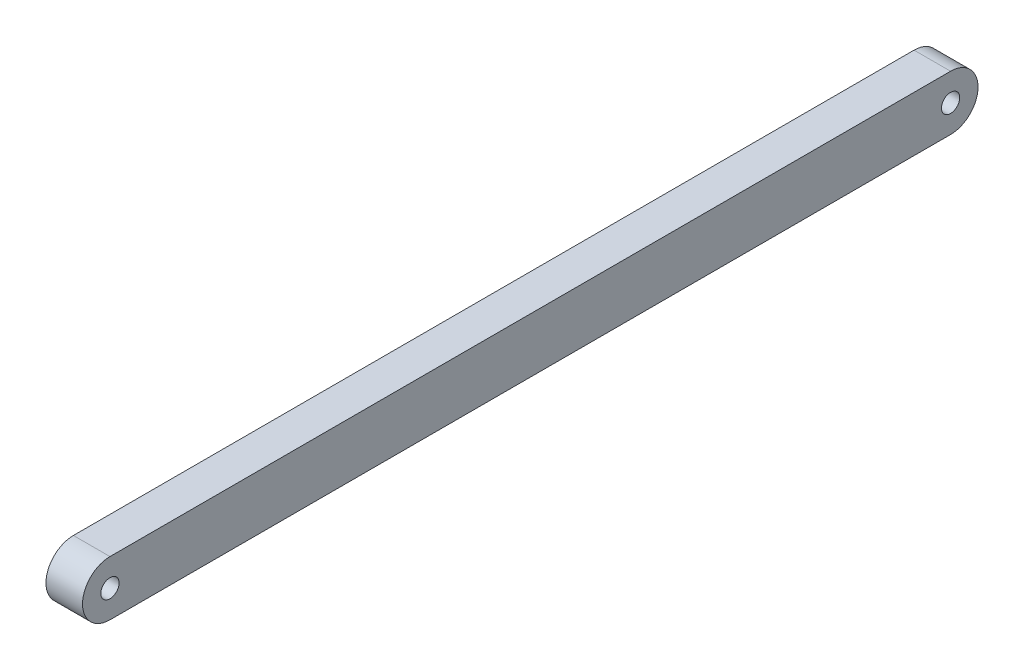
from build123d import *

# Parameters (mm, degrees)
SKETCH_1_R      = 0.5
EXTRUDE_1_DEPTH = 2


with BuildPart() as part:
    # 草图1 → 凸台-拉伸1 (new body)
    with BuildSketch(Plane(origin=(0, 0, 0), x_dir=(0, 0, -1), z_dir=(1, 0, 0))):
        with BuildLine():
            Line((0, 1.5), (46, 1.5))
            ThreePointArc((46, 1.5), (47.5, 0), (46, -1.5))
            Line((46, -1.5), (0, -1.5))
            ThreePointArc((0, -1.5), (-1.5, 0), (0, 1.5))
        make_face()
        Circle(SKETCH_1_R, mode=Mode.SUBTRACT)
        with Locations((46, 0)):
            Circle(SKETCH_1_R, mode=Mode.SUBTRACT)
    extrude(amount=EXTRUDE_1_DEPTH)


solid = part.part
